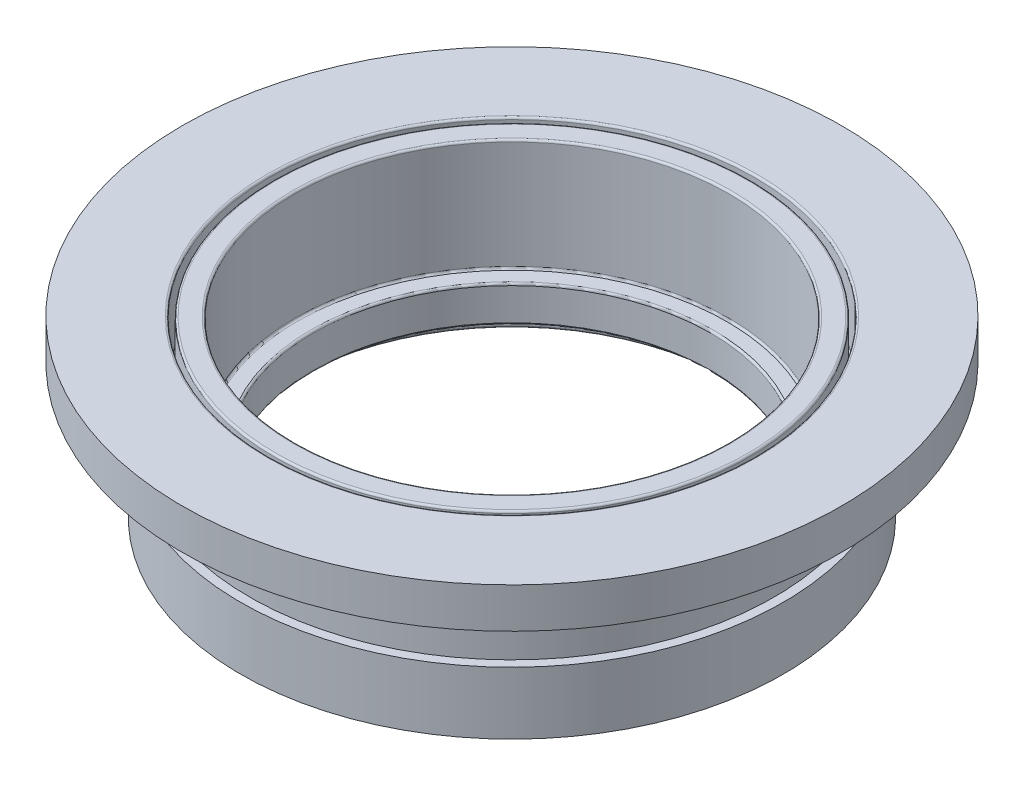
from build123d import *

# Parameters (mm, degrees)
BODY_MOVE_COPY1_ANGLE = 90


with BuildPart() as part:
    # Sketch1 → Revolve1 (revolve)
    with BuildSketch(Plane(origin=(0, 0, 0), x_dir=(1, 0, 0), z_dir=(0, 1, 0)), mode=Mode.PRIVATE) as revolve1_sk:
        with BuildLine():
            Line((27, 30.088078699), (27, 26.088078699))
            Line((27, 26.088078699), (26.1, 26.088078699))
            Line((26.1, 26.088078699), (26.1, 22.888078699))
            Line((26.1, 22.888078699), (27, 22.888078699))
            Line((27, 22.888078699), (27, 16.688078699))
            Line((27, 16.688078699), (25.2, 16.688078699))
            Line((25.2, 16.688078699), (25.2, 32.655378704))
            ThreePointArc((25.2, 32.655378704), (25.141421356, 32.79680006), (25, 32.855378704))
            Line((25, 32.855378704), (24.9, 32.855378704))
            ThreePointArc((24.9, 32.855378704), (24.758578644, 32.79680006), (24.7, 32.655378704))
            Line((24.7, 32.655378704), (24.7, 27.655378704))
            ThreePointArc((24.7, 27.655378704), (24.641421356, 27.513957348), (24.5, 27.455378704))
            Line((24.5, 27.455378704), (23.4, 27.455378704))
            ThreePointArc((23.4, 27.455378704), (23.258578644, 27.513957348), (23.2, 27.655378704))
            Line((23.2, 27.655378704), (23.2, 32.655378704))
            ThreePointArc((23.2, 32.655378704), (23.141421356, 32.79680006), (23, 32.855378704))
            Line((23, 32.855378704), (22.9, 32.855378704))
            ThreePointArc((22.9, 32.855378704), (22.758578644, 32.79680006), (22.7, 32.655378704))
            Line((22.7, 32.655378704), (22.7, 17.959377585))
            ThreePointArc((22.7, 17.959377585), (22.641421356, 17.817956229), (22.5, 17.759377585))
            Line((22.5, 17.759377585), (21.8, 17.759377585))
            ThreePointArc((21.8, 17.759377585), (21.658578644, 17.817956229), (21.6, 17.959377585))
            Line((21.6, 17.959377585), (21.6, 19.088078699))
            ThreePointArc((21.6, 19.088078699), (21.541421356, 19.229500055), (21.4, 19.288078699))
            Line((21.4, 19.288078699), (20, 19.288078699))
            ThreePointArc((20, 19.288078699), (19.858578644, 19.346657343), (19.8, 19.488078699))
            Line((19.8, 19.488078699), (19.8, 22.688078699))
            ThreePointArc((19.8, 22.688078699), (19.858578644, 22.829500055), (20, 22.888078699))
            Line((20, 22.888078699), (21.4, 22.888078699))
            ThreePointArc((21.4, 22.888078699), (21.541421356, 22.946657343), (21.6, 23.088078699))
            Line((21.6, 23.088078699), (21.6, 33.8))
            ThreePointArc((21.6, 33.8), (21.658578644, 33.941421356), (21.8, 34))
            Line((21.8, 34), (22.5, 34))
            Line((22.5, 34), (23.5, 34))
            ThreePointArc((23.5, 34), (23.641421356, 33.941421356), (23.7, 33.8))
            Line((23.7, 33.8), (23.7, 28.155378704))
            ThreePointArc((23.7, 28.155378704), (23.758578644, 28.013957348), (23.9, 27.955378704))
            Line((23.9, 27.955378704), (24, 27.955378704))
            ThreePointArc((24, 27.955378704), (24.141421356, 28.013957348), (24.2, 28.155378704))
            Line((24.2, 28.155378704), (24.2, 33.888078699))
            ThreePointArc((24.2, 33.888078699), (24.258578644, 34.029500055), (24.4, 34.088078699))
            Line((24.4, 34.088078699), (25.2, 34.088078699))
            Line((25.2, 34.088078699), (32.8, 34.088078699))
            Line((32.8, 34.088078699), (32.8, 30.088078699))
            Line((32.8, 30.088078699), (27, 30.088078699))
        make_face()
    revolve(revolve1_sk.sketch.rotate(Axis((0, 0, -34), (0, 0, 1)), 180), axis=Axis((0, 0, -34), (0, 0, 1)))


with BuildPart() as part_1:
    # Body-Move/Copy1: moved
    add(part.part.rotate(Axis((0, 0, 0), (1, 0, 0)), BODY_MOVE_COPY1_ANGLE))


solid = part_1.part
